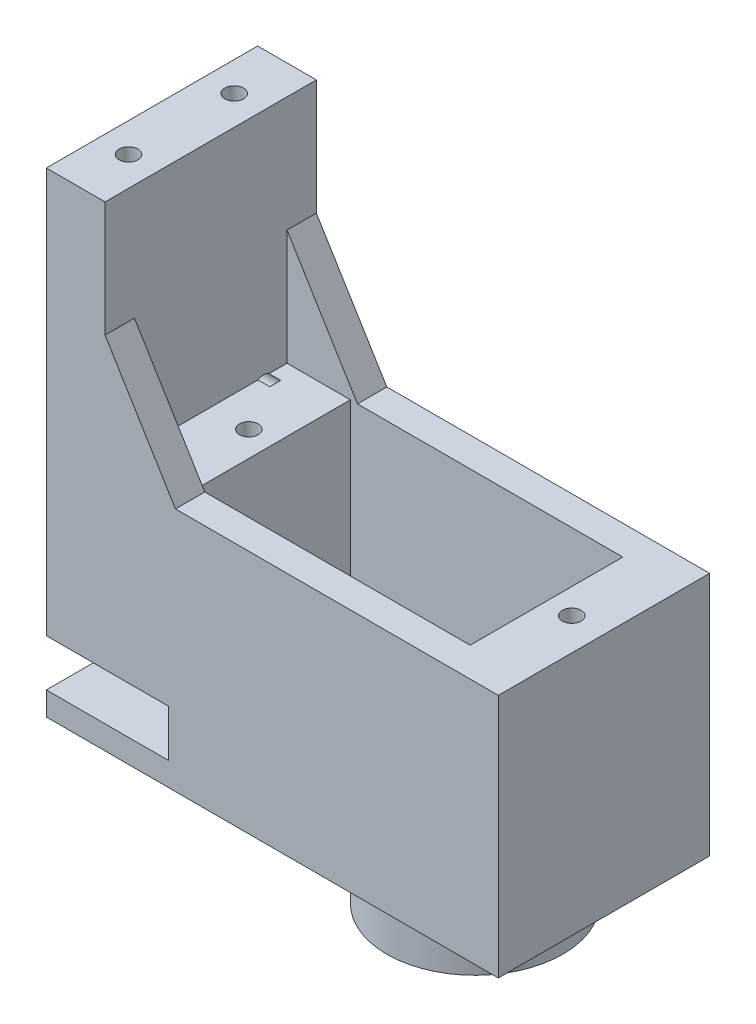
from build123d import *

# Parameters (mm, degrees)
SKETCH1_W               = 38.5
SKETCH1_H               = 20.85
BOSS_EXTRUDE1_DEPTH     = 9
SKETCH2_W               = 5
SKETCH2_H               = 19.65
BOSS_EXTRUDE2_DEPTH     = 9
SKETCH3_R               = 7.5
BOSS_EXTRUDE3_DEPTH     = 4.5
SKETCH4_W               = 23.2
SKETCH4_H               = 13
CUT_EXTRUDE1_DEPTH      = 18.85
SKETCH5_R               = 5
CUT_EXTRUDE3_DEPTH      = 4
SKETCH6_W               = 1.4
SKETCH6_H               = 13
CUT_EXTRUDE5_DEPTH      = 5.8
CUT_EXTRUDE6_DEPTH      = 35.351710292
CUT_EXTRUDE6_DEPTH_BACK = 35.351710292
SKETCH7_W               = 10.4
SKETCH7_H               = 4
SKETCH8_R               = 0.8
CUT_EXTRUDE7_DEPTH      = 8
SKETCH9_R               = 0.8
CUT_EXTRUDE8_DEPTH      = 8
SKETCH10_R              = 0.8
CUT_EXTRUDE9_DEPTH      = 10
SKETCH11_R              = 0.8
CUT_EXTRUDE10_DEPTH     = 10
BOSS_EXTRUDE4_DEPTH     = 9
SKETCH13_W              = 6
SKETCH13_H              = 13
CUT_EXTRUDE11_DEPTH     = 9.85
SKETCH14_R              = 0.8
CUT_EXTRUDE13_DEPTH     = 6


with BuildPart() as part:
    # Sketch1 → Boss-Extrude1 (new, symmetric)
    with BuildSketch(Plane.XY):
        with Locations((-2.75, -5.275)):
            Rectangle(SKETCH1_W, SKETCH1_H)
    extrude(amount=BOSS_EXTRUDE1_DEPTH, both=True)

    # Sketch2 → Boss-Extrude2 (add, symmetric)
    with BuildSketch(Plane.XY):
        with Locations((-19.5, 14.975)):
            Rectangle(SKETCH2_W, SKETCH2_H)
    extrude(amount=BOSS_EXTRUDE2_DEPTH, both=True)

    # Sketch3 → Boss-Extrude3 (add)
    with BuildSketch(Plane(origin=(0, -20.2, 0), x_dir=(1, 0, 0), z_dir=(0, 1, 0))):
        with Locations(Location((5.5, 0, 0), (0, 0, 270))):
            Circle(SKETCH3_R)
    extrude(amount=BOSS_EXTRUDE3_DEPTH)

    # Sketch4 → Cut-Extrude1 (cut)
    with BuildSketch(Plane(origin=(0, 5.15, 0), x_dir=(1, 0, 0), z_dir=(0, 1, 0))):
        Rectangle(SKETCH4_W, SKETCH4_H)
    extrude(amount=-CUT_EXTRUDE1_DEPTH, mode=Mode.SUBTRACT)

    # Sketch5 → Cut-Extrude3 (cut)
    with BuildSketch(Plane(origin=(0, -20.2, 0), x_dir=(1, 0, 0), z_dir=(0, 1, 0))):
        with Locations(Location((5.5, 0, 0), (0, 0, 270))):
            Circle(SKETCH5_R)
    extrude(amount=CUT_EXTRUDE3_DEPTH, mode=Mode.SUBTRACT)

    # Sketch6 → Cut-Extrude5 (cut)
    with BuildSketch(Plane(origin=(0, -13.7, 0), x_dir=(1, 0, 0), z_dir=(0, 1, 0))):
        with Locations((12.3, 0)):
            Rectangle(SKETCH6_W, SKETCH6_H)
    extrude(amount=CUT_EXTRUDE5_DEPTH, mode=Mode.SUBTRACT)

    # Sketch7 → Cut-Extrude6 (cut, two sides: drawn at the far end of the back side and taken through both)
    with BuildSketch(Plane.XY.offset(-CUT_EXTRUDE6_DEPTH_BACK)):
        with Locations((-16.8, -11.7)):
            Rectangle(SKETCH7_W, SKETCH7_H)
    extrude(amount=CUT_EXTRUDE6_DEPTH + CUT_EXTRUDE6_DEPTH_BACK, mode=Mode.SUBTRACT)

    # Sketch8 → Cut-Extrude7 (cut)
    with BuildSketch(Plane(origin=(0, 5.15, 0), x_dir=(1, 0, 0), z_dir=(0, 1, 0))):
        with Locations(Location((-13.75, 0, 0), (0, 0, 270))):
            Circle(SKETCH8_R)
    extrude(amount=-CUT_EXTRUDE7_DEPTH, mode=Mode.SUBTRACT)

    # Sketch9 → Cut-Extrude8 (cut)
    with BuildSketch(Plane(origin=(0, 5.15, 0), x_dir=(1, 0, 0), z_dir=(0, 1, 0))):
        with Locations(Location((13.75, 0, 0), (0, 0, 270))):
            Circle(SKETCH9_R)
    extrude(amount=-CUT_EXTRUDE8_DEPTH, mode=Mode.SUBTRACT)

    # Sketch10 → Cut-Extrude9 (cut)
    with BuildSketch(Plane(origin=(0, 24.8, 0), x_dir=(1, 0, 0), z_dir=(0, 1, 0))):
        with Locations(Location((-19.5, -4.5, 0), (0, 0, 270))):
            Circle(SKETCH10_R)
    extrude(amount=-CUT_EXTRUDE9_DEPTH, mode=Mode.SUBTRACT)

    # Sketch11 → Cut-Extrude10 (cut)
    with BuildSketch(Plane(origin=(0, 24.8, 0), x_dir=(1, 0, 0), z_dir=(0, 1, 0))):
        with Locations(Location((-19.5, 4.5, 0), (0, 0, 270))):
            Circle(SKETCH11_R)
    extrude(amount=-CUT_EXTRUDE10_DEPTH, mode=Mode.SUBTRACT)

    # Sketch12 → Boss-Extrude4 (add, symmetric)
    with BuildSketch(Plane.XY):
        Polygon((-17, 5.15), (-11, 5.15), (-17, 14.975), align=None)
    extrude(amount=BOSS_EXTRUDE4_DEPTH, both=True)

    # Sketch13 → Cut-Extrude11 (cut)
    with BuildSketch(Plane(origin=(0, 15, 0), x_dir=(1, 0, 0), z_dir=(0, 1, 0))):
        with Locations((-14, 0)):
            Rectangle(SKETCH13_W, SKETCH13_H)
    extrude(amount=-CUT_EXTRUDE11_DEPTH, mode=Mode.SUBTRACT)

    # Sketch14 → Cut-Extrude13 (cut)
    with BuildSketch(Plane(origin=(-22, 0, 0), x_dir=(0, 0, -1), z_dir=(1, 0, 0))):
        with Locations((-4.5, -4.5)):
            Circle(SKETCH14_R)
        with Locations((4.5, -4.5)):
            Circle(SKETCH14_R)
        with Locations(Location((-4.5, 4.5, 0), (0, 0, 125.659087696))):
            Circle(SKETCH14_R)
        with Locations(Location((4.5, 4.5, 0), (0, 0, 125.659087696))):
            Circle(SKETCH14_R)
    extrude(amount=CUT_EXTRUDE13_DEPTH, mode=Mode.SUBTRACT)


solid = part.part
